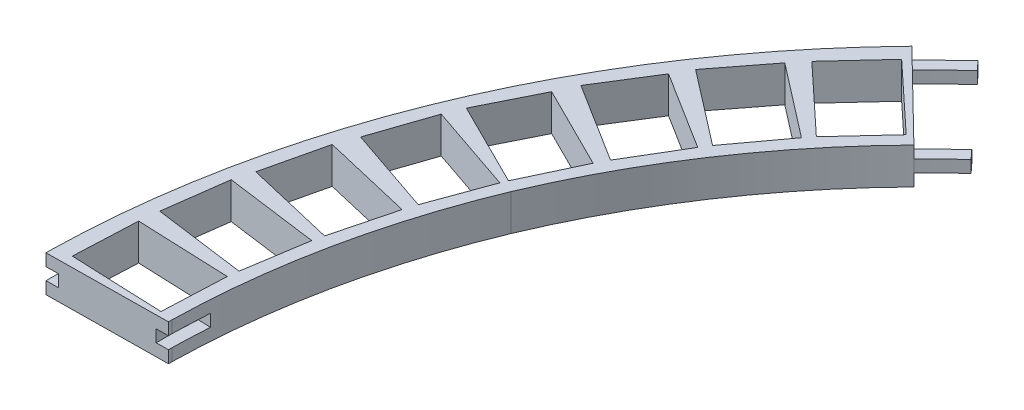
from build123d import *

# Parameters (mm, degrees)
BOSS_EXTRUDE1_DEPTH = 12
SKETCH3_W           = 4.4
SKETCH3_H           = 4
CUT_REVOLVE1_ANGLE  = 3
SKETCH4_W           = 4
SKETCH4_H           = 4
REVOLVE1_ANGLE      = 3


with BuildPart() as part:
    # Sketch1 → Boss-Extrude1 (new body)
    with BuildSketch(Plane(origin=(0, 0, 0), x_dir=(1, 0, 0), z_dir=(0, 1, 0))):
        with BuildLine():
            Line((-211.174799688, 206.201137862), (-182.564973394, 178.265140079))
            ThreePointArc((-182.564973394, 178.265140079), (-212.957593109, 140.868101899), (-235.777573605, 98.424041209))
            ThreePointArc((-235.777573605, 98.424041209), (-249.780718251, 52.966609881), (-255.104275502, 5.700069272))
            Line((-255.104275502, 5.700069272), (-255.104275502, 4.568862205))
            Line((-255.104275502, 4.568862205), (-295.085665641, 4.092423829))
            Line((-295.085665641, 4.092423829), (-295.085665641, 6.176990522))
            ThreePointArc((-295.085665641, 6.176990522), (-272.171507635, 114.17694912), (-211.174799688, 206.201137862))
        make_face()
        Polygon((-288.853949055, 28.475508763), (-289.795828236, 7.496641691), (-259.297708464, 6.269015395), (-258.355829283, 27.247882467), align=None, mode=Mode.SUBTRACT)
        Polygon((-288.202969042, 34.784391797), (-257.949644018, 30.724233072), (-254.683431263, 51.47416217), (-285.407974911, 55.597560966), align=None, mode=Mode.SUBTRACT)
        Polygon((-283.612878523, 61.915838046), (-253.89939669, 54.933619681), (-248.631031599, 75.267631401), (-278.809043274, 82.359007245), align=None, mode=Mode.SUBTRACT)
        Polygon((-276.255921554, 89.176800074), (-247.361344598, 79.340855863), (-240.142390382, 99.066838813), (-269.488694715, 109.056554622), align=None, mode=Mode.SUBTRACT)
        Polygon((-230.355302506, 120.079310533), (-239.303938624, 101.075373705), (-267.042878446, 114.91557665), (-257.667257096, 133.706471368), align=None, mode=Mode.SUBTRACT)
        Polygon((-217.599523923, 141.890991255), (-228.352118631, 123.846340791), (-254.61522008, 140.315994772), (-243.458357706, 158.107128012), align=None, mode=Mode.SUBTRACT)
        Polygon((-203.234989184, 161.794735755), (-215.691212171, 144.88112549), (-240.228428406, 163.826442046), (-227.39588109, 180.449490275), align=None, mode=Mode.SUBTRACT)
        Polygon((-186.795494279, 179.950119438), (-201.048962764, 164.528101536), (-223.368087677, 185.348741273), (-209.114619192, 200.770759174), align=None, mode=Mode.SUBTRACT)
    extrude(amount=BOSS_EXTRUDE1_DEPTH)

    # Sketch3 → Cut-Revolve1 (revolve, cut)
    with BuildSketch(Plane(origin=(-0.090657576, 0, -7.607732879), x_dir=(0.9999290060329473, 0, -0.01191565751279397), z_dir=(0.01191565751279397, 0, 0.9999290060329473))):
        with Locations((-256.83172364, 6.020050252)):
            Rectangle(SKETCH3_W, SKETCH3_H)
        with Locations((-293.215952418, 6.020050252)):
            Rectangle(SKETCH3_W, SKETCH3_H)
    revolve(axis=Axis((-0.090657576, 0, -7.607732879), (0, -1, 0)), revolution_arc=CUT_REVOLVE1_ANGLE, mode=Mode.SUBTRACT)

    # Sketch4 → Revolve1 (revolve)
    with BuildSketch(Plane(origin=(0, 0, 0), x_dir=(-0.715482223100618, 0, -0.6986309386414242), z_dir=(0.6986309386414242, 0, -0.715482223100618))):
        with Locations((257.163535165, 6)):
            Rectangle(SKETCH4_W, SKETCH4_H)
        with Locations((293.150309637, 6)):
            Rectangle(SKETCH4_W, SKETCH4_H)
    revolve(axis=Axis((0, 0, 0), (0, -1, 0)), revolution_arc=REVOLVE1_ANGLE)


solid = part.part
